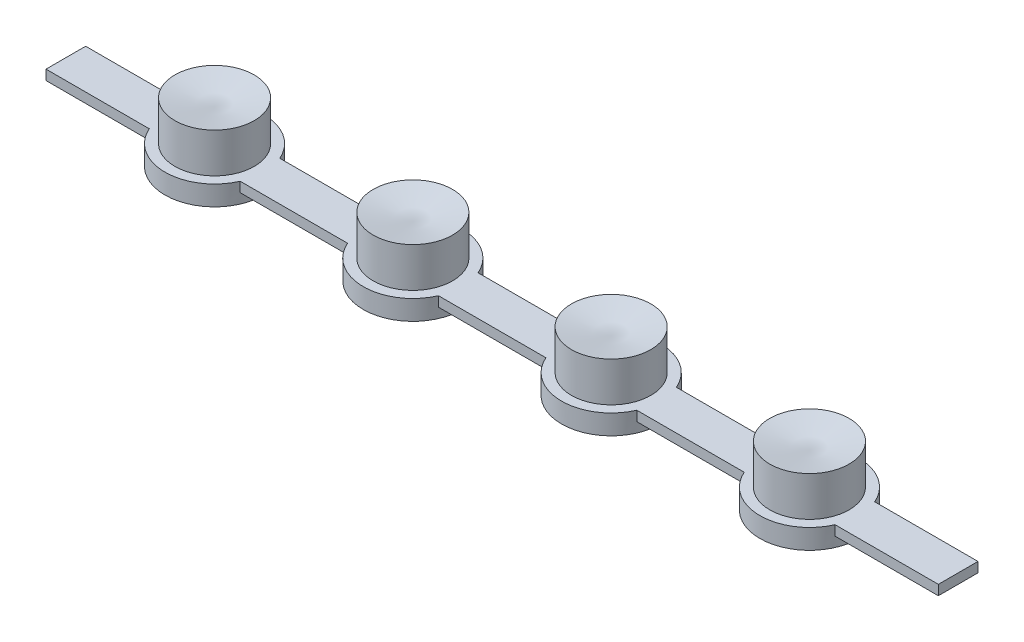
from build123d import *

# Parameters (mm, degrees)
SKETCH1_R           = 2
BOSS_EXTRUDE1_DEPTH = 3
SKETCH3_R           = 2.5
BOSS_EXTRUDE3_DEPTH = 1
LPATTERN4_COUNT     = 4
LPATTERN4_PITCH     = 10
SKETCH4_W           = 45
SKETCH4_H           = 2
BOSS_EXTRUDE4_DEPTH = 0.5


with BuildPart() as part:
    # Sketch1 → Boss-Extrude1 (new body)
    with BuildSketch(Plane(origin=(0, 0, 0), x_dir=(1, 0, 0), z_dir=(0, 1, 0))):
        with Locations(Location((0, 0, 0), (0, 0, 270))):
            Circle(SKETCH1_R)
    extrude(amount=BOSS_EXTRUDE1_DEPTH)

    # Sketch2 → Cut-Revolve1 (revolve, cut)
    with BuildSketch(Plane(origin=(0, 0, 0), x_dir=(0, 0, -1), z_dir=(1, 0, 0))):
        Polygon((0, 3), (0, 2.6), (-2, 3), align=None)
    revolve(axis=Axis((0, 3, 0), (0, -1, 0)), mode=Mode.SUBTRACT)

    # Sketch3 → Boss-Extrude3 (add)
    with BuildSketch(Plane(origin=(0, 0, 0), x_dir=(1, 0, 0), z_dir=(0, 1, 0))):
        with Locations(Location((0, 0, 0), (0, 0, 270))):
            Circle(SKETCH3_R)
    extrude(amount=BOSS_EXTRUDE3_DEPTH)


with BuildPart() as lpattern4_1:
    # LPattern4: pattern copy
    add(part.part.moved(Location(Vector(1, 0, 0) * (1 * LPATTERN4_PITCH))))


with BuildPart() as lpattern4_2:
    # LPattern4: pattern copy
    add(part.part.moved(Location(Vector(1, 0, 0) * (2 * LPATTERN4_PITCH))))


with BuildPart() as lpattern4_3:
    # LPattern4: pattern copy
    add(part.part.moved(Location(Vector(1, 0, 0) * (3 * LPATTERN4_PITCH))))


with BuildPart() as part_1:
    add(part.part)

    add(lpattern4_1.part)  # Boss-Extrude4 merges LPattern4_1

    add(lpattern4_2.part)  # Boss-Extrude4 merges LPattern4_2

    add(lpattern4_3.part)  # Boss-Extrude4 merges LPattern4_3
    # Sketch4 → Boss-Extrude4 (add)
    with BuildSketch(Plane(origin=(0, 1, 0), x_dir=(1, 0, 0), z_dir=(0, 1, 0))):
        with Locations((15, 0)):
            Rectangle(SKETCH4_W, SKETCH4_H)
    extrude(amount=-BOSS_EXTRUDE4_DEPTH)


solid = part_1.part
